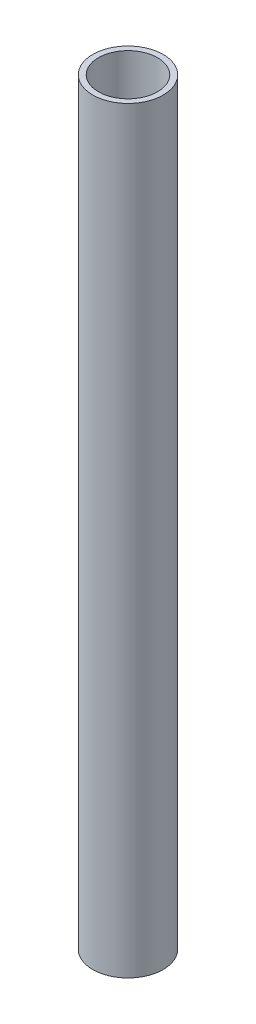
from build123d import *

# Parameters (mm, degrees)
CROQUIS1_R              = 12.5
CROQUIS1_R_2            = 10.5
SALIENTE_EXTRUIR1_DEPTH = 269


with BuildPart() as part:
    # Croquis1 → Saliente-Extruir1 (new body)
    with BuildSketch(Plane(origin=(0, 0, 0), x_dir=(1, 0, 0), z_dir=(0, 1, 0))):
        with Locations(Location((0, 0, 0), (0, 0, 270))):
            Circle(CROQUIS1_R)
        with Locations(Location((0, 0, 0), (0, 0, 270))):
            Circle(CROQUIS1_R_2, mode=Mode.SUBTRACT)
    extrude(amount=SALIENTE_EXTRUIR1_DEPTH)


solid = part.part
